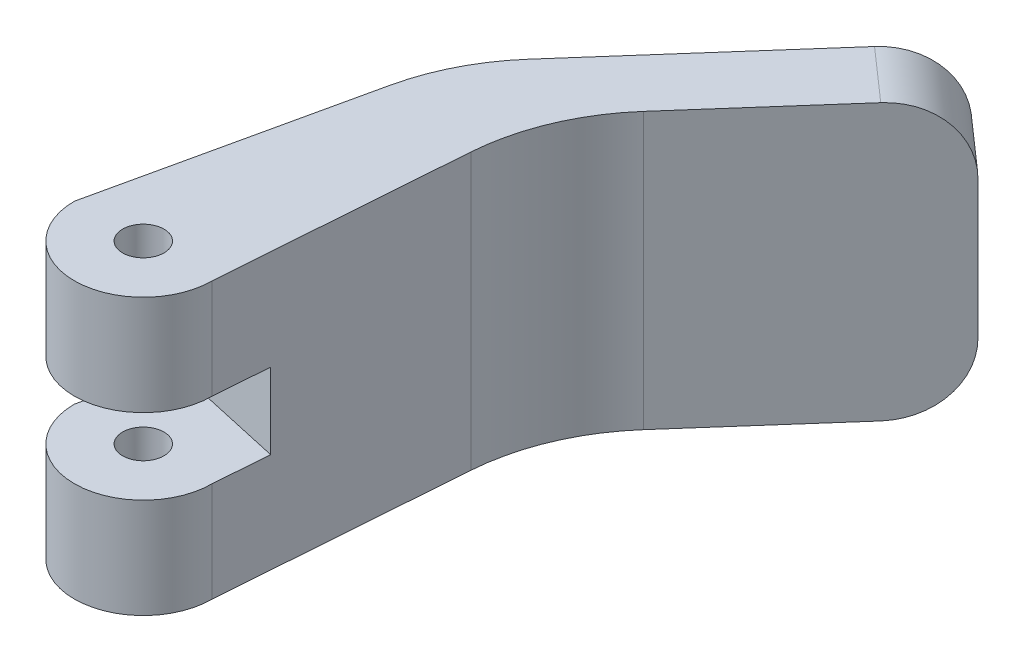
from build123d import *

# Parameters (mm, degrees)
BOSS_EXTRUDE1_DEPTH = 40
FILLET1_R           = 10
FILLET2_R           = 30
FILLET3_R           = 30
SKETCH3_R           = 3
CUT_EXTRUDE1_DEPTH  = 50
SKETCH5_W           = 20
SKETCH5_H           = 11
CUT_EXTRUDE2_DEPTH  = 50


with BuildPart() as part:
    # Sketch2 → Boss-Extrude1 (new body)
    with BuildSketch(Plane(origin=(0, 0, 0), x_dir=(1, 0, 0), z_dir=(0, 1, 0))):
        with BuildLine():
            Line((-10, 0), (0, 45))
            Line((0, 45), (35.22081686, 85))
            Line((35.22081686, 85), (42.726014623, 78.391520103))
            Line((42.726014623, 78.391520103), (13.324099267, 45))
            Line((13.324099267, 45), (10, 0))
            ThreePointArc((10, 0), (0, -10), (-10, 0))
        make_face()
    extrude(amount=BOSS_EXTRUDE1_DEPTH)

    # Fillet1
    fillet1_edges = [part.edges().sort_by_distance(p)[0] for p in [
        (38.973415741, 0, -81.695760051),
        (38.973415741, 40, -81.695760051),
    ]]
    fillet(fillet1_edges, radius=FILLET1_R)

    # Fillet2
    fillet2_edges = [part.edges().sort_by_distance(p)[0] for p in [
        (0, 20, -45),
    ]]
    fillet(fillet2_edges, radius=FILLET2_R)

    # Fillet3
    fillet3_edges = [part.edges().sort_by_distance(p)[0] for p in [
        (13.324099267, 20, -45),
    ]]
    fillet(fillet3_edges, radius=FILLET3_R)

    # Sketch3 → Cut-Extrude1 (cut)
    with BuildSketch(Plane(origin=(0, 40, 0), x_dir=(1, 0, 0), z_dir=(0, 1, 0))):
        Circle(SKETCH3_R)
    extrude(amount=-CUT_EXTRUDE1_DEPTH, mode=Mode.SUBTRACT)

    # Sketch5 → Cut-Extrude2 (cut)
    with BuildSketch(Plane(origin=(-9.529411765, 0, -2.117647059), x_dir=(-0.21693045781865625, 0, 0.9761870601839528), z_dir=(-0.9761870601839528, 0, -0.21693045781865625))):
        with Locations((0, 20)):
            Rectangle(SKETCH5_W, SKETCH5_H)
    extrude(amount=-CUT_EXTRUDE2_DEPTH, mode=Mode.SUBTRACT)


solid = part.part
